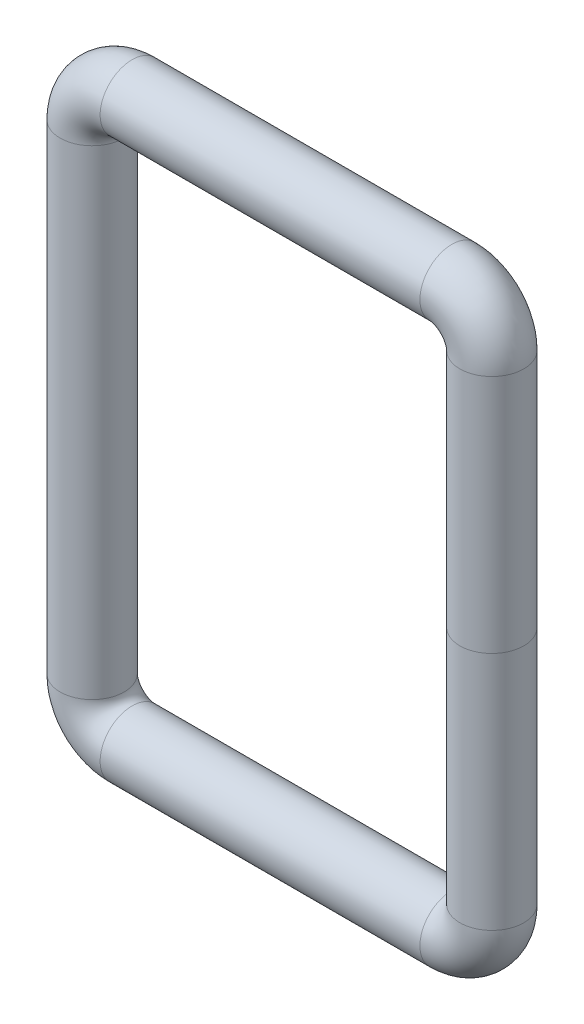
from build123d import *

# Parameters (mm, degrees)
SKETCH2_R = 0.4


with BuildPart() as part:
    # Sweep1: sweep along a path in Sketch1
    with BuildLine(Plane.XY) as sweep1_path:
        Line((-2.5, 3), (-2.5, -3))
        ThreePointArc((-2.5, -3), (-2.353553391, -3.353553391), (-2, -3.5))
        Line((-2, -3.5), (2, -3.5))
        ThreePointArc((2, -3.5), (2.353553391, -3.353553391), (2.5, -3))
        Line((2.5, -3), (2.5, 3))
        ThreePointArc((2.5, 3), (2.353553391, 3.353553391), (2, 3.5))
        Line((2, 3.5), (-2, 3.5))
        ThreePointArc((-2, 3.5), (-2.353553391, 3.353553391), (-2.5, 3))
    # Sketch2 → Sweep1 (sweep)
    with BuildSketch(Plane(origin=(0, 0, 0), x_dir=(1, 0, 0), z_dir=(0, 1, 0))):
        with Locations((2.5, 0)):
            Circle(SKETCH2_R)
    sweep(path=sweep1_path.line)


solid = part.part
